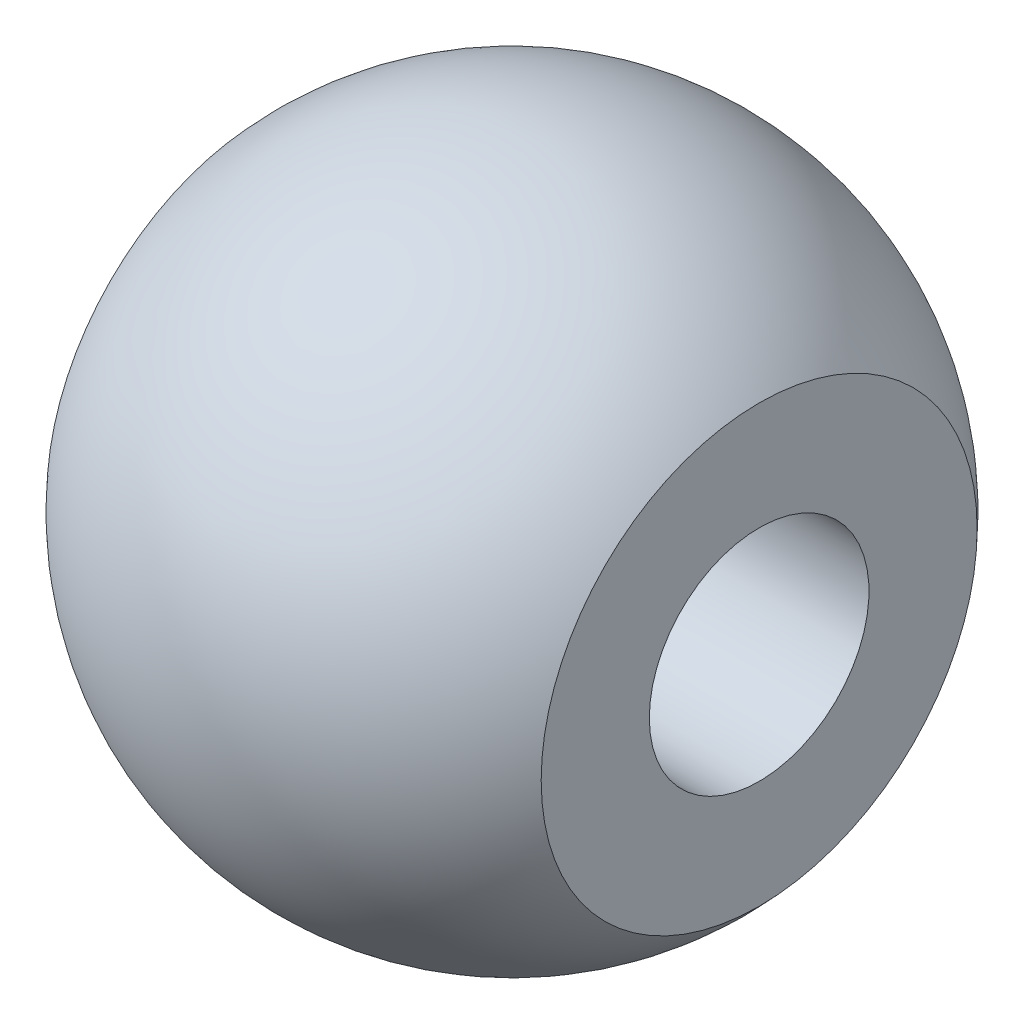
from build123d import *

# Parameters (mm, degrees)
SKETCH2_R          = 2
CUT_EXTRUDE1_DEPTH = 12.66190379


with BuildPart() as part:
    # Sketch1 → Revolve1 (revolve)
    with BuildSketch(Plane.XY, mode=Mode.PRIVATE) as revolve1_sk:
        with BuildLine():
            Line((4.5, 0), (-3.5, 0))
            Line((-3.5, 0), (-3.5, 2))
            Line((-3.5, 2), (-4.5, 3))
            Line((-4.5, 3), (-4.5, 3.968626967))
            ThreePointArc((-4.5, 3.968626967), (0, 6), (4.5, 3.968626967))
            Line((4.5, 3.968626967), (4.5, 0))
        make_face()
    revolve(revolve1_sk.sketch.rotate(Axis((4.5, 0, 0), (-1, 0, 0)), 90), axis=Axis((4.5, 0, 0), (-1, 0, 0)))

    # Sketch2 → Cut-Extrude1 (cut, through all)
    with BuildSketch(Plane.ZY.offset(3.5)):
        Circle(SKETCH2_R)
    extrude(amount=-CUT_EXTRUDE1_DEPTH, mode=Mode.SUBTRACT)


solid = part.part
